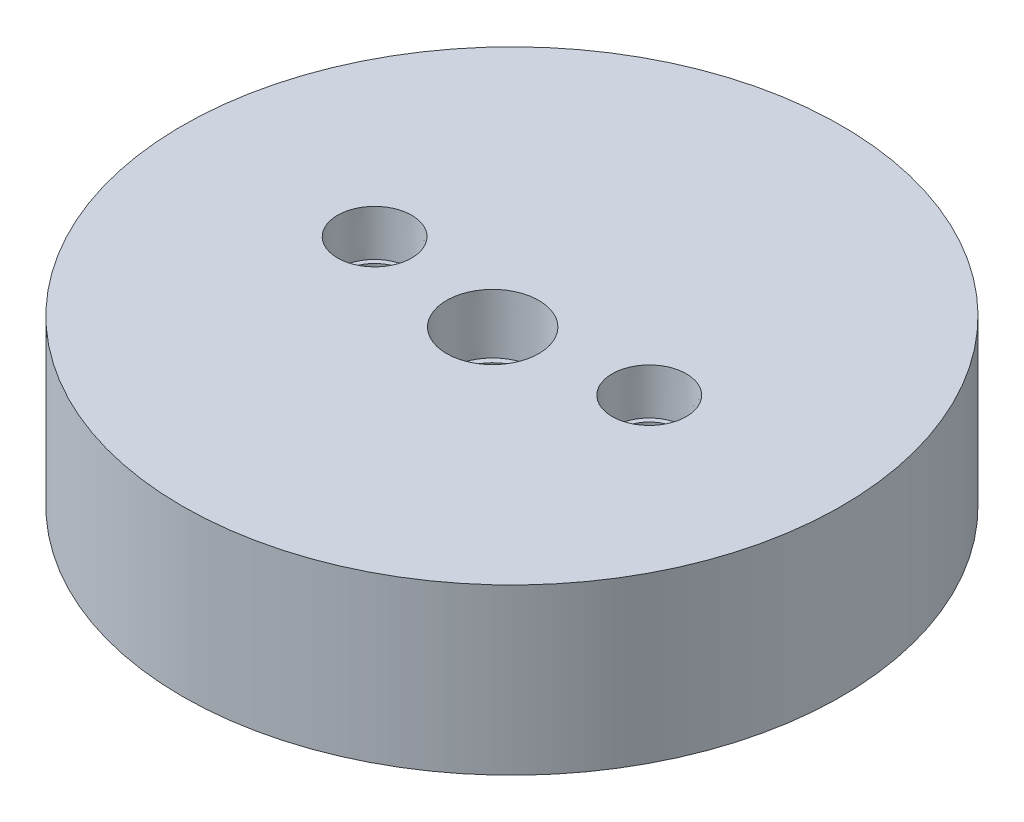
from build123d import *

# Parameters (mm, degrees)
SKETCH1_R                                      = 76.2
BILLET_DEPTH                                   = 50.8
SKETCH3_R                                      = 19.05
LOX_PLATE_DEPTH                                = 13.97
SKETCH5_R                                      = 13.97
LOX_DOME_DEPTH                                 = 20.32
SKETCH7_R                                      = 76.2
TOP_MILL_DEPTH                                 = 12.7
SKETCH12_R                                     = 60.96
KEROSENE_PLATE_DEPTH                           = 10.16
KEROSENE_INLET_3_8_NPT_TAPPED_HOLE1_AT_2_COUNT = 2
KEROSENE_INLET_3_8_NPT_TAPPED_HOLE1_AT_2_PITCH = 63.5


with BuildPart() as part:
    # Sketch1 → Billet (new body)
    with BuildSketch(Plane(origin=(0, 0, 0), x_dir=(1, 0, 0), z_dir=(0, 1, 0))):
        Circle(SKETCH1_R)
    extrude(amount=-BILLET_DEPTH)

    # Sketch3 → Lox Plate (cut)
    with BuildSketch(Plane(origin=(0, -50.8, 0), x_dir=(1, 0, 0), z_dir=(0, 1, 0))):
        Circle(SKETCH3_R)
    extrude(amount=LOX_PLATE_DEPTH, mode=Mode.SUBTRACT)

    # Sketch5 → Lox Dome (cut)
    with BuildSketch(Plane(origin=(0, -50.8, 0), x_dir=(1, 0, 0), z_dir=(0, 1, 0))):
        Circle(SKETCH5_R)
    extrude(amount=LOX_DOME_DEPTH, mode=Mode.SUBTRACT)

    # Sketch7 → Top Mill (cut)
    with BuildSketch(Plane(origin=(0, 0, 0), x_dir=(1, 0, 0), z_dir=(0, 1, 0))):
        Circle(SKETCH7_R)
    extrude(amount=-TOP_MILL_DEPTH, mode=Mode.SUBTRACT)

    # Sketch12 → Kerosene Plate (cut)
    with BuildSketch(Plane(origin=(0, -50.8, 0), x_dir=(1, 0, 0), z_dir=(0, 1, 0))):
        Circle(SKETCH12_R)
    extrude(amount=KEROSENE_PLATE_DEPTH, mode=Mode.SUBTRACT)

    # Sketch21 → Lox Inlet-1/2 NPT Tapped Hole3 (revolve, cut)
    with BuildSketch(Plane(origin=(0, -12.7, 4.445), x_dir=(0, 0, 1), z_dir=(1, 0, 0))):
        Polygon((0, 0), (0, 38.1), (8.9281, 38.1), (8.9281, 13.462), (10.261665792, 13.462), (10.6647361, 0), align=None)
    revolve(axis=Axis((0, -6.35, 4.445), (0, -1, 0)), mode=Mode.SUBTRACT)

    # Sketch25 → Kerosene Inlet-3/8 NPT Tapped Hole1 (revolve, cut)
    with BuildSketch(Plane(origin=(-31.75, -12.7, 0), x_dir=(0, 0, 1), z_dir=(1, 0, 0))):
        Polygon((0, 0), (0, 38.1), (7.1374, 38.1), (7.1374, 10.414), (8.263205494, 10.414), (8.5750146, 0), align=None)
    kerosene_inlet_3_8_npt_tapped_hole1 = revolve(axis=Axis((-31.75, -6.35, 0), (0, -1, 0)), mode=Mode.SUBTRACT)

    # Kerosene Inlet-3/8 NPT Tapped Hole1 at 2: Kerosene Inlet-3/8 NPT Tapped Hole1 ×2
    with Locations(*[(i * KEROSENE_INLET_3_8_NPT_TAPPED_HOLE1_AT_2_PITCH, 0, 0) for i in range(1, KEROSENE_INLET_3_8_NPT_TAPPED_HOLE1_AT_2_COUNT)]):
        add(kerosene_inlet_3_8_npt_tapped_hole1, mode=Mode.SUBTRACT)


solid = part.part
